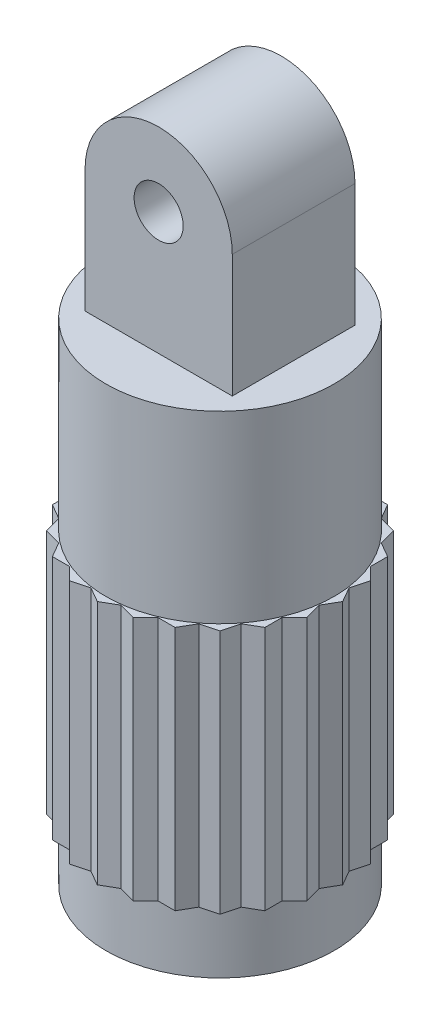
from build123d import *

# Parameters (mm, degrees)
SKETCH3_R           = 4.65
BOSS_EXTRUDE1_DEPTH = 20
SKETCH4_R           = 1
BOSS_EXTRUDE2_DEPTH = 2.5
BOSS_EXTRUDE3_START = -2.5
BOSS_EXTRUDE3_DEPTH = 10
CIRPATTERN1_COUNT   = 4
CIRPATTERN1_ANGLE   = 45


with BuildPart() as part:
    # Sketch3 → Boss-Extrude1 (new body)
    with BuildSketch(Plane(origin=(0, 0, 0), x_dir=(1, 0, 0), z_dir=(0, 1, 0))):
        with Locations(Location((0, 0, 0), (0, 0, 270))):
            Circle(SKETCH3_R)
    extrude(amount=BOSS_EXTRUDE1_DEPTH)

    # Sketch4 → Boss-Extrude2 (add, symmetric)
    with BuildSketch(Plane.XY):
        with BuildLine():
            Line((3, 20), (-3, 20))
            Line((-3, 20), (-3, 25))
            ThreePointArc((-3, 25), (0, 28), (3, 25))
            Line((3, 25), (3, 20))
        make_face()
        with Locations((0, 25)):
            Circle(SKETCH4_R, mode=Mode.SUBTRACT)
    extrude(amount=BOSS_EXTRUDE2_DEPTH, both=True)

    # Sketch5 → Boss-Extrude3 (add)
    with BuildSketch(Plane.XZ.offset(BOSS_EXTRUDE3_START)):
        Polygon((-5, 0), (-2.5, -4.330127019), (2.5, -4.330127019), (5, 0), (2.5, 4.330127019), (-2.5, 4.330127019), align=None)
    boss_extrude3 = extrude(amount=-BOSS_EXTRUDE3_DEPTH)

    # CirPattern1: Boss-Extrude3 ×4 about axis
    cirpattern1_axis = Axis((0, 0, 0), (0, -1, 0))
    for i in range(1, CIRPATTERN1_COUNT):
        add(boss_extrude3.rotate(cirpattern1_axis, i * CIRPATTERN1_ANGLE / (CIRPATTERN1_COUNT - 1)))


solid = part.part
